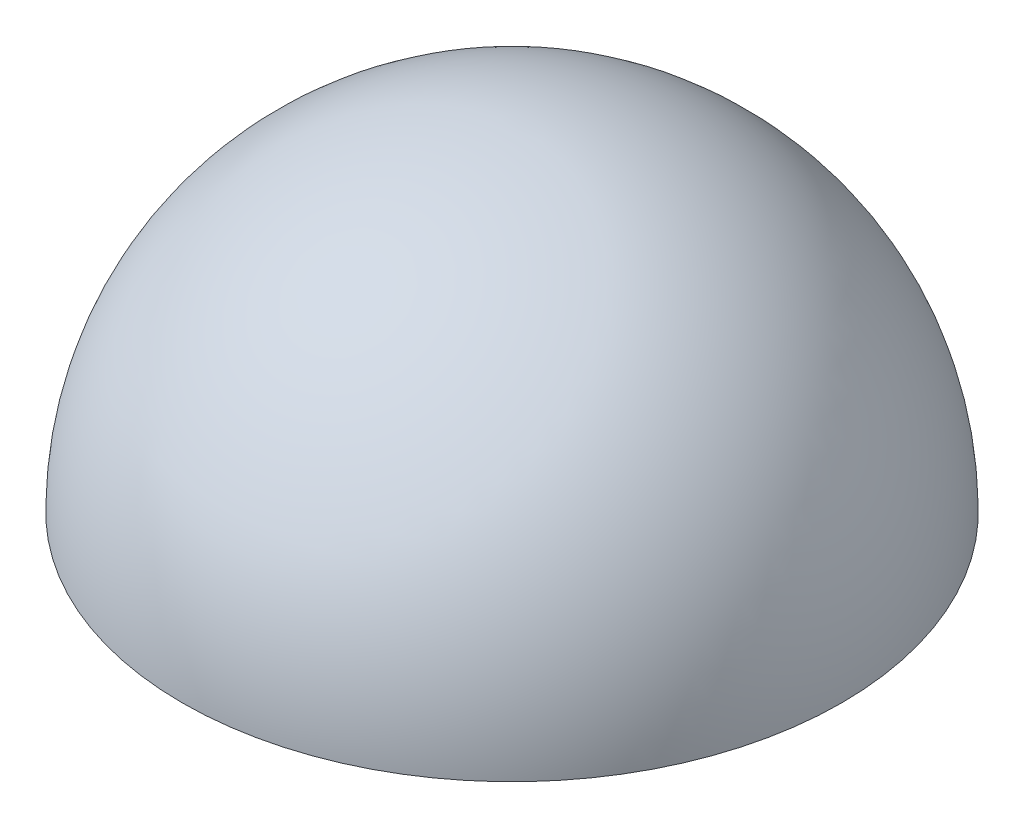
from build123d import *


with BuildPart() as part:
    # Esquisse2 → Révolution1 (revolve)
    with BuildSketch(Plane.XY):
        with BuildLine():
            Line((16.75, 0), (0, 0))
            Line((0, 0), (0, 16.75))
            ThreePointArc((0, 16.75), (11.844038585, 11.844038585), (16.75, 0))
        make_face()
    revolve(axis=Axis((0, 20.735426009, 0), (0, -1, 0)))


solid = part.part
